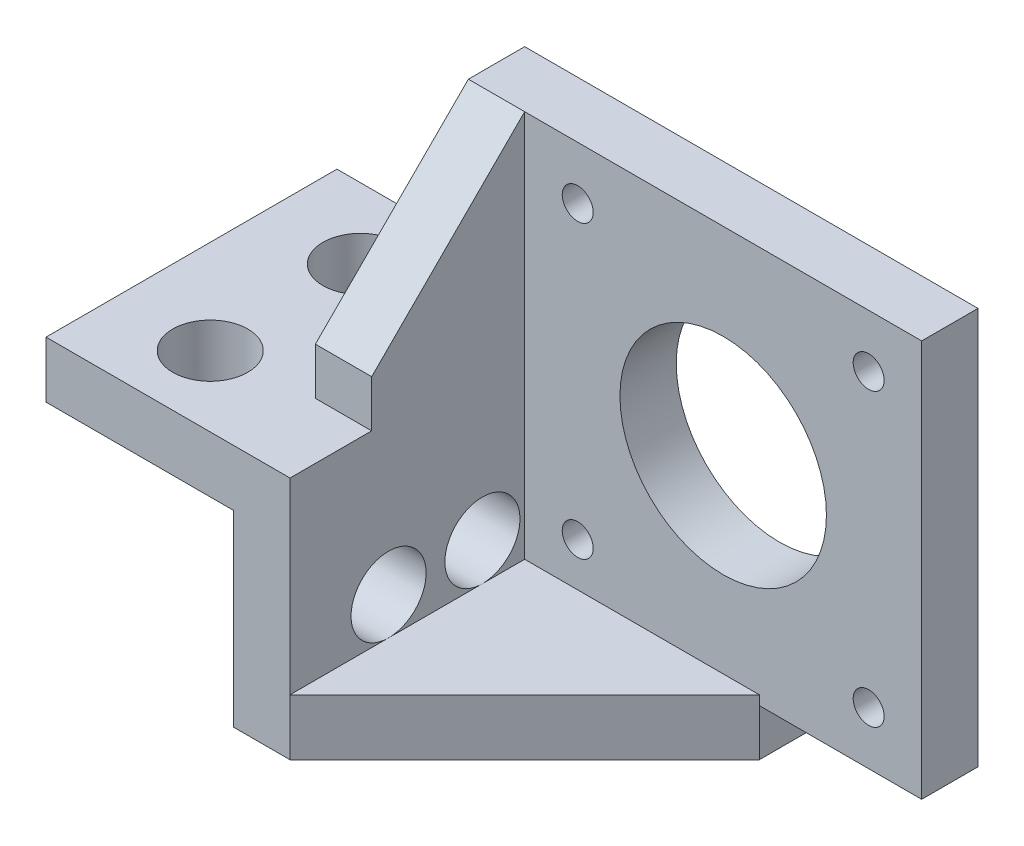
from build123d import *

# Parameters (mm, degrees)
BOSS_EXTRUDE3_DEPTH = 31
SKETCH3_R           = 1.65
SKETCH3_R_2         = 11
BOSS_EXTRUDE4_DEPTH = 6
SKETCH4_R           = 4
CUT_EXTRUDE1_DEPTH  = 6
SKETCH7_R           = 4
CUT_EXTRUDE2_DEPTH  = 75.371903297
SKETCH10_W          = 21.3
SKETCH10_H          = 6
BOSS_EXTRUDE6_DEPTH = 6
SKETCH11_W          = 25
SKETCH11_H          = 6
BOSS_EXTRUDE7_DEPTH = 5
BOSS_EXTRUDE8_DEPTH = 1


with BuildPart() as part:
    # Sketch2 → Boss-Extrude3 (new body)
    with BuildSketch(Plane(origin=(0, 0, 0), x_dir=(0, 1, 0), z_dir=(0, 0, 1))):
        Polygon((26, 0), (20, 0), (20, -20), (0, -20), (0, -26), (26, -26), align=None)
    extrude(amount=BOSS_EXTRUDE3_DEPTH)

    # Sketch3 → Boss-Extrude4 (add)
    with BuildSketch(Plane(origin=(0, 0, 0), x_dir=(1, 0, 0), z_dir=(0, 0, -1))):
        Polygon((68.3, -5), (26, -5), (26, -26), (26, -47.3), (68.3, -47.3), align=None)
        with Locations(Location((31.65, -41.65, 0), (0, 0, 180))):
            Circle(SKETCH3_R, mode=Mode.SUBTRACT)
        with Locations(Location((62.65, -41.65, 0), (0, 0, 180))):
            Circle(SKETCH3_R, mode=Mode.SUBTRACT)
        with Locations(Location((31.65, -10.65, 0), (0, 0, 180))):
            Circle(SKETCH3_R, mode=Mode.SUBTRACT)
        with Locations(Location((47.15, -26.15, 0), (0, 0, 180))):
            Circle(SKETCH3_R_2, mode=Mode.SUBTRACT)
        with Locations(Location((62.65, -10.65, 0), (0, 0, 180))):
            Circle(SKETCH3_R, mode=Mode.SUBTRACT)
    extrude(amount=-BOSS_EXTRUDE4_DEPTH)

    # Sketch4 → Cut-Extrude1 (cut)
    with BuildSketch(Plane.XZ.offset(-20)):
        with Locations((10, 7.5)):
            Circle(SKETCH4_R)
        with Locations((10, 23.5)):
            Circle(SKETCH4_R)
    extrude(amount=-CUT_EXTRUDE1_DEPTH, mode=Mode.SUBTRACT)

    # Sketch7 → Cut-Extrude2 (cut, through all)
    with BuildSketch(Plane(origin=(20, 0, 0), x_dir=(0, -1, 0), z_dir=(-1, 0, 0))):
        with Locations(Location((-10, 20.5, 0), (0, 0, 90))):
            Circle(SKETCH7_R)
        with Locations(Location((-10, 10.5, 0), (0, 0, 90))):
            Circle(SKETCH7_R)
    extrude(amount=-CUT_EXTRUDE2_DEPTH, mode=Mode.SUBTRACT)

    # Sketch10 → Boss-Extrude6 (add)
    with BuildSketch(Plane(origin=(26, 0, 0), x_dir=(0, -1, 0), z_dir=(-1, 0, 0))):
        with Locations((-36.65, 3)):
            Rectangle(SKETCH10_W, SKETCH10_H)
        Polygon((-47.3, 6), (-26, 6), (-26, 22.3), (-31, 22.3), align=None)
    extrude(amount=BOSS_EXTRUDE6_DEPTH)

    # Sketch11 → Boss-Extrude7 (add)
    with BuildSketch(Plane.XZ.offset(-5)):
        Polygon((26, 31), (26, 6), (51, 6), align=None)
        with Locations((38.5, 3)):
            Rectangle(SKETCH11_W, SKETCH11_H)
    extrude(amount=BOSS_EXTRUDE7_DEPTH)

    # Sketch13 → Boss-Extrude8 (add)
    with BuildSketch(Plane(origin=(0, 5, 0), x_dir=(-1, 0, 0), z_dir=(0, 1, 0))):
        Polygon((-51, 6), (-26, 31), (-26, 6), align=None)
    extrude(amount=BOSS_EXTRUDE8_DEPTH)


solid = part.part
